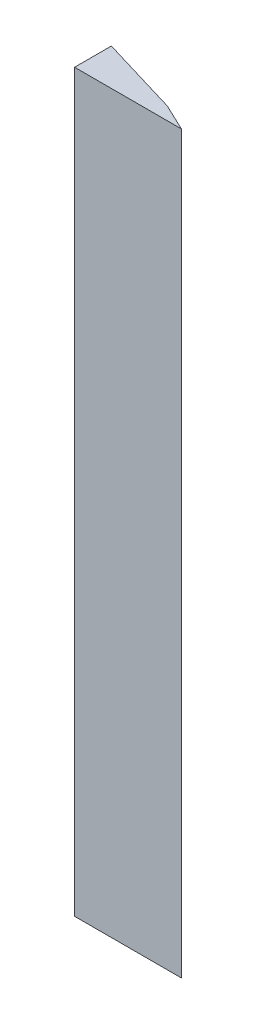
from build123d import *

# Parameters (mm, degrees)
BOSS_EXTRUDE1_DEPTH = 150
CUT_EXTRUDE1_DEPTH  = 150


with BuildPart() as part:
    # Sketch2 → Boss-Extrude1 (new body)
    with BuildSketch(Plane(origin=(0, 0, 0), x_dir=(1, 0, 0), z_dir=(0, 1, 0))):
        Polygon((0, 0), (0, 7.5), (25, 0), align=None)
    extrude(amount=BOSS_EXTRUDE1_DEPTH)

    # Sketch3 → Cut-Extrude1 (cut)
    with BuildSketch(Plane(origin=(0, 150, 0), x_dir=(1, 0, 0), z_dir=(0, 1, 0))):
        Polygon((16.310149398, 2.606955181), (21.789173845, 0), (25, 0), align=None)
    extrude(amount=-CUT_EXTRUDE1_DEPTH, mode=Mode.SUBTRACT)


solid = part.part
